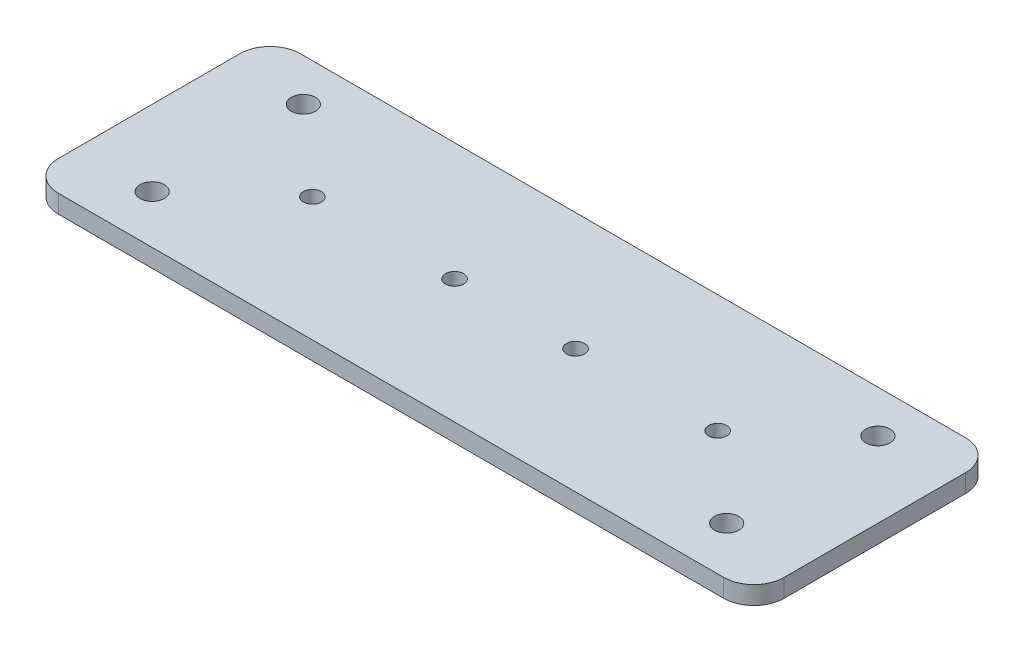
from build123d import *

# Parameters (mm, degrees)
SKETCH_1_W      = 120
SKETCH_1_H      = 40
SKETCH_1_R      = 1.5
SKETCH_1_R_2    = 2
EXTRUDE_1_DEPTH = 3
FILLET_1_R      = 5


with BuildPart() as part:
    # 草图1 → 凸台-拉伸1 (new body)
    with BuildSketch(Plane(origin=(0, 0, 0), x_dir=(1, 0, 0), z_dir=(0, 1, 0))):
        with Locations((0, 20)):
            Rectangle(SKETCH_1_W, SKETCH_1_H)
        with Locations(Location((10, 20.5, 0), (0, 0, 270))):
            Circle(SKETCH_1_R, mode=Mode.SUBTRACT)
        with Locations(Location((-10, 20.5, 0), (0, 0, 270))):
            Circle(SKETCH_1_R, mode=Mode.SUBTRACT)
        with Locations(Location((-33.5, 20.5, 0), (0, 0, 270))):
            Circle(SKETCH_1_R, mode=Mode.SUBTRACT)
        with Locations(Location((33.5, 20.5, 0), (0, 0, 270))):
            Circle(SKETCH_1_R, mode=Mode.SUBTRACT)
        with Locations(Location((-47.5, 8, 0), (0, 0, 270))):
            Circle(SKETCH_1_R_2, mode=Mode.SUBTRACT)
        with Locations(Location((-47.5, 33, 0), (0, 0, 270))):
            Circle(SKETCH_1_R_2, mode=Mode.SUBTRACT)
        with Locations(Location((47.5, 33, 0), (0, 0, 270))):
            Circle(SKETCH_1_R_2, mode=Mode.SUBTRACT)
        with Locations(Location((47.5, 8, 0), (0, 0, 270))):
            Circle(SKETCH_1_R_2, mode=Mode.SUBTRACT)
    extrude(amount=EXTRUDE_1_DEPTH)

    # 圆角1
    fillet_1_edges = [part.edges().sort_by_distance(p)[0] for p in [
        (-60, 1.5, -40),
        (60, 1.5, -40),
        (60, 1.5, 0),
        (-60, 1.5, 0),
    ]]
    fillet(fillet_1_edges, radius=FILLET_1_R)


solid = part.part
